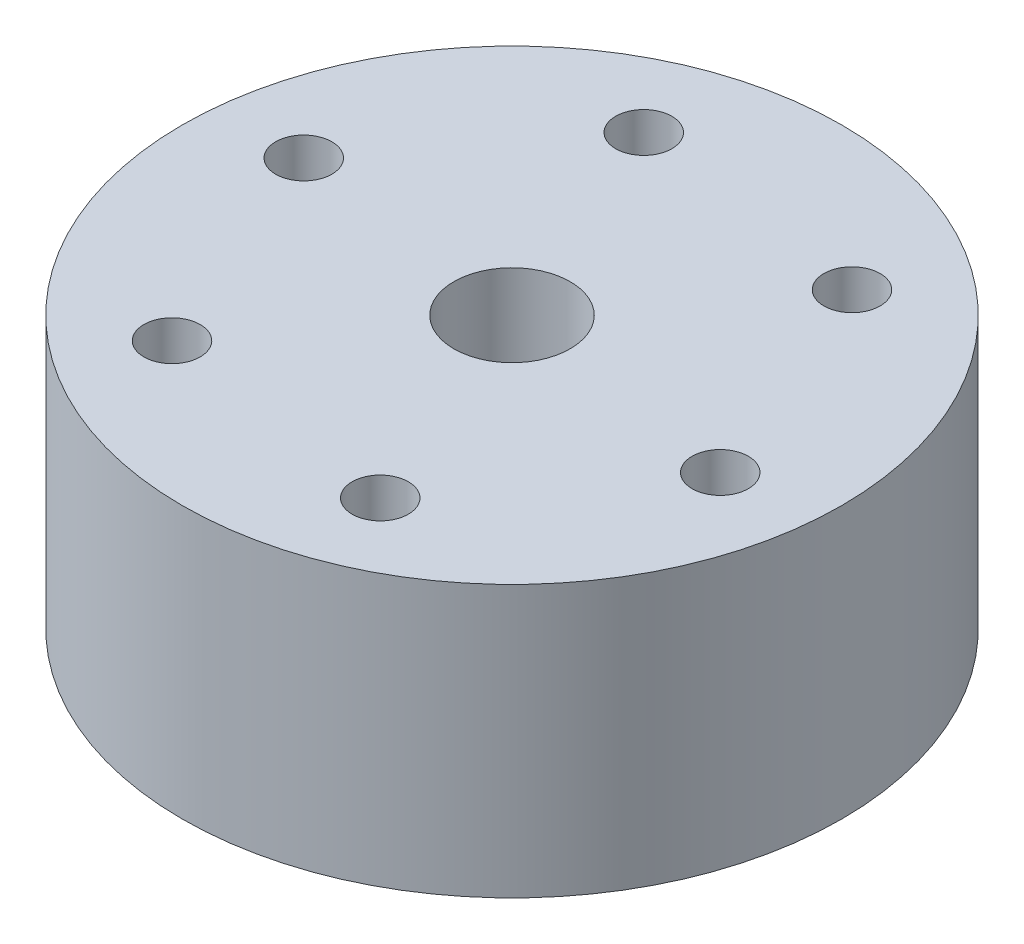
from build123d import *

# Parameters (mm, degrees)
CUBO_START          = 20.5
SK_CUBO_R           = 17
CUBO_DEPTH          = 14
PASANTES_M2_5_START = 20.5
SK_PASANTES_M2_5_R  = 1.45
PASANTES_M2_5_DEPTH = 14
CENTRO_START        = 20.5
SK_CENTRO_R         = 3
CENTRO_DEPTH        = 14


with BuildPart() as part:
    # Sk_Cubo → Cubo (new body)
    with BuildSketch(Plane(origin=(0, 0, 0), x_dir=(1, 0, 0), z_dir=(0, 1, 0)).offset(CUBO_START)):
        with Locations(Location((0, -490, 0), (0, 0, 270))):
            Circle(SK_CUBO_R)
    extrude(amount=CUBO_DEPTH)

    # Sk_Pasantes_M2-5 → Pasantes_M2-5 (cut)
    with BuildSketch(Plane(origin=(0, 0, 0), x_dir=(1, 0, 0), z_dir=(0, 1, 0)).offset(PASANTES_M2_5_START)):
        with Locations(Location((12.390194253, -491.653204878, 0), (0, 0, 270))):
            Circle(SK_PASANTES_M2_5_R)
        with Locations(Location((4.763379704, -501.55682542, 0), (0, 0, 270))):
            Circle(SK_PASANTES_M2_5_R)
        with Locations(Location((-7.626814549, -499.903620542, 0), (0, 0, 270))):
            Circle(SK_PASANTES_M2_5_R)
        with Locations(Location((-12.390194253, -488.346795122, 0), (0, 0, 270))):
            Circle(SK_PASANTES_M2_5_R)
        with Locations(Location((-4.763379704, -478.44317458, 0), (0, 0, 270))):
            Circle(SK_PASANTES_M2_5_R)
        with Locations(Location((7.626814549, -480.096379458, 0), (0, 0, 270))):
            Circle(SK_PASANTES_M2_5_R)
    extrude(amount=PASANTES_M2_5_DEPTH, mode=Mode.SUBTRACT)

    # Sk_Centro → Centro (cut)
    with BuildSketch(Plane(origin=(0, 0, 0), x_dir=(1, 0, 0), z_dir=(0, 1, 0)).offset(CENTRO_START)):
        with Locations(Location((0, -490, 0), (0, 0, 270))):
            Circle(SK_CENTRO_R)
    extrude(amount=CENTRO_DEPTH, mode=Mode.SUBTRACT)


solid = part.part
